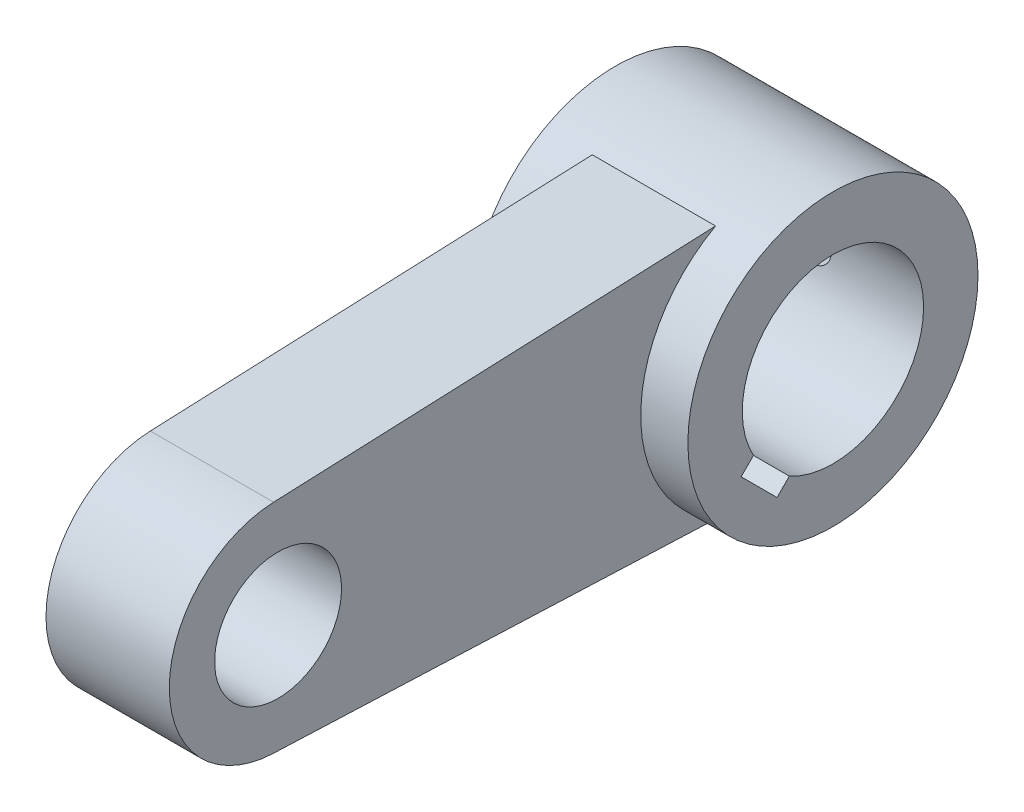
from build123d import *

# Parameters (mm, degrees)
SKETCH1_R           = 40
SKETCH1_R_2         = 25
BOSS_EXTRUDE1_DEPTH = 30
BOSS_EXTRUDE2_DEPTH = 17
SKETCH3_R           = 17.5
CUT_EXTRUDE1_DEPTH  = 181.856296545
CUT_EXTRUDE2_DEPTH  = 185.661853126
SKETCH6_R           = 4.5
CUT_EXTRUDE3_DEPTH  = 24


with BuildPart() as part:
    # Sketch1 → Boss-Extrude1 (new, symmetric)
    with BuildSketch(Plane(origin=(0, 0, 0), x_dir=(0, 0, -1), z_dir=(1, 0, 0))):
        Circle(SKETCH1_R)
        Circle(SKETCH1_R_2, mode=Mode.SUBTRACT)
    extrude(amount=BOSS_EXTRUDE1_DEPTH, both=True)

    # Sketch2 → Boss-Extrude2 (add, symmetric)
    with BuildSketch(Plane(origin=(0, 0, 0), x_dir=(0, 0, -1), z_dir=(1, 0, 0))):
        with BuildLine():
            Line((-19.364916731, 35), (-141.236028691, 29.974526403))
            ThreePointArc((-141.236028691, 29.974526403), (-170, 0), (-141.236028691, -29.974526403))
            Line((-141.236028691, -29.974526403), (-19.364916731, -35))
            ThreePointArc((-19.364916731, -35), (-40, 0), (-19.364916731, 35))
        make_face()
    extrude(amount=BOSS_EXTRUDE2_DEPTH, both=True)

    # Sketch3 → Cut-Extrude1 (cut, through all)
    with BuildSketch(Plane(origin=(17, 0, 0), x_dir=(0, 0, -1), z_dir=(1, 0, 0))):
        with Locations((-140, 0)):
            Circle(SKETCH3_R)
    extrude(amount=-CUT_EXTRUDE1_DEPTH, mode=Mode.SUBTRACT)

    # Sketch5 → Cut-Extrude2 (cut, through all)
    with BuildSketch(Plane(origin=(30, 0, 0), x_dir=(0, 0, -1), z_dir=(1, 0, 0))):
        Polygon((-3.702856162, 6.196638775), (-25.314422766, -15.41492783), (-15.41492783, -25.314422766), (6.196638775, -3.702856162), align=None)
    extrude(amount=-CUT_EXTRUDE2_DEPTH, mode=Mode.SUBTRACT)

    # Sketch6 → Cut-Extrude3 (cut)
    with BuildSketch(Plane.XY.offset(-35)):
        with Locations(Location((0, 0, 0), (0, 0, 180))):
            Circle(SKETCH6_R)
    extrude(amount=CUT_EXTRUDE3_DEPTH, mode=Mode.SUBTRACT)


solid = part.part
